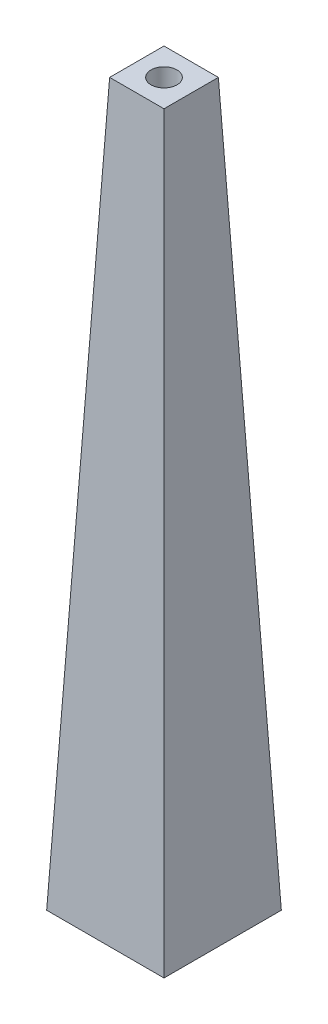
from build123d import *

# Parameters (mm, degrees)
SKETCH1_W           = 47.625
SKETCH1_H           = 47.625
BOSS_EXTRUDE1_DEPTH = 381
BOSS_EXTRUDE1_TAPER = 2.5
SKETCH2_R           = 3.429
CUT_EXTRUDE1_DEPTH  = 381
SKETCH3_W           = 47.625
SKETCH3_H           = 47.625
CUT_EXTRUDE2_DEPTH  = 190.5
SKETCH4_W           = 15.875
SKETCH4_H           = 15.875
CUT_EXTRUDE3_DEPTH  = 6.985
CUT_EXTRUDE3_DRAFT  = -30


with BuildPart() as part:
    # Sketch1 → Boss-Extrude1 (new body)
    with BuildSketch(Plane(origin=(0, 0, 0), x_dir=(1, 0, 0), z_dir=(0, 1, 0))):
        with Locations((23.8125, -23.8125)):
            Rectangle(SKETCH1_W, SKETCH1_H)
    extrude(amount=BOSS_EXTRUDE1_DEPTH, taper=BOSS_EXTRUDE1_TAPER)

    # Sketch2 → Cut-Extrude1 (cut)
    with BuildSketch(Plane.XZ):
        with Locations(Location((23.8125, 23.8125, 0), (0, 0, 270))):
            Circle(SKETCH2_R)
    extrude(amount=-CUT_EXTRUDE1_DEPTH, mode=Mode.SUBTRACT)

    # Sketch3 → Cut-Extrude2 (cut)
    with BuildSketch(Plane.XZ):
        with Locations((23.8125, 23.8125)):
            Rectangle(SKETCH3_W, SKETCH3_H)
    extrude(amount=-CUT_EXTRUDE2_DEPTH, mode=Mode.SUBTRACT)


with BuildPart() as cut_extrude3_tool:
    # Sketch4 → Cut-Extrude3 (with draft: the straight prism first)
    with BuildSketch(Plane.XZ.offset(-190.5)):
        with Locations((23.8125, 23.8125)):
            Rectangle(SKETCH4_W, SKETCH4_H)
    extrude(amount=-CUT_EXTRUDE3_DEPTH)
    # Cut-Extrude3: the draft: its side faces are tilted about the plane it starts from
    cut_extrude3_sides = [cut_extrude3_tool.faces().sort_by_distance(p)[0] for p in [
        (15.875, 193.9925, 23.8125),
        (23.8125, 193.9925, 15.875),
        (31.75, 193.9925, 23.8125),
        (23.8125, 193.9925, 31.75),
    ]]
    draft(cut_extrude3_sides, Plane.XZ.offset(-190.5), CUT_EXTRUDE3_DRAFT)


with BuildPart() as part_1:
    add(part.part)

    # Cut-Extrude3: cut by cut_extrude3_tool
    add(cut_extrude3_tool.part, mode=Mode.SUBTRACT)


solid = part_1.part
